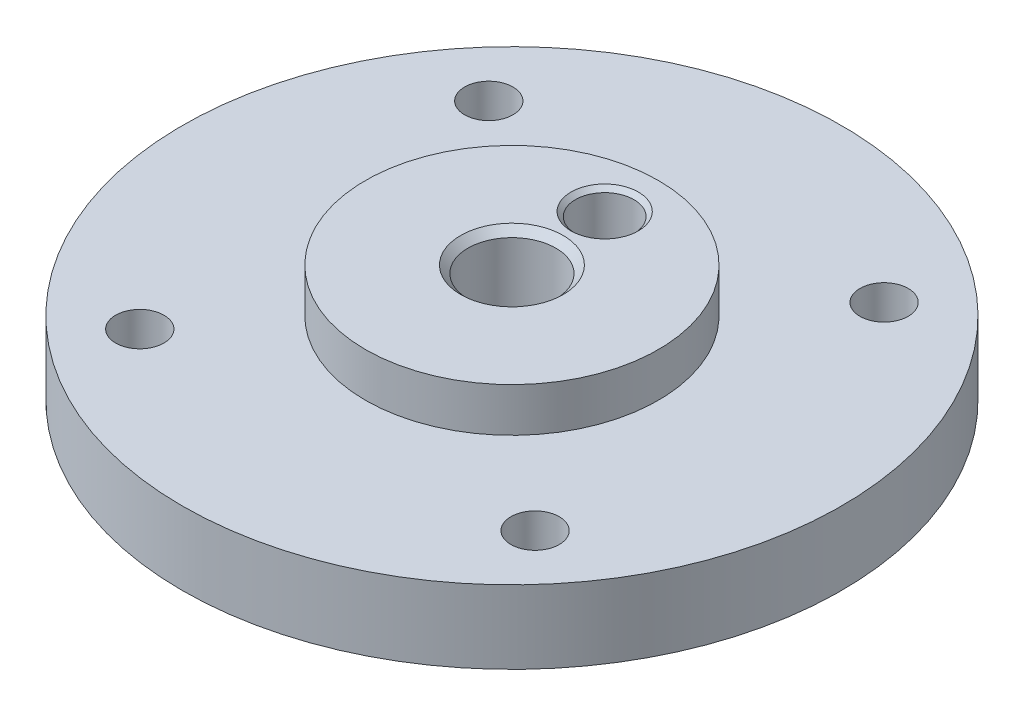
from build123d import *

# Parameters (mm, degrees)
SKETCH_1_R               = 22.5
EXTRUDE_1_DEPTH          = 5
SKETCH_2_R               = 10
EXTRUDE_2_DEPTH          = 5
EXTRUDE_START            = 3
SKETCH_4_R               = 10
EXTRUDE_3_DEPTH          = 3
CUT_EXTRUDE_2_DEPTH      = 35.372954485
CUT_EXTRUDE_2_DEPTH_BACK = 35.372954485
SKETCH_5_R               = 3
HOLE_WIZARD_M4_3_D       = 3.3
SKETCH_10_R              = 2
CUT_EXTRUDE_3_DEPTH      = 35.372954485
CHAMFER_2_SIZE           = 0.5
CHAMFER_4_SIZE           = 0.3


with BuildPart() as part:
    # 草图1 → 凸台-拉伸1 (new body)
    with BuildSketch(Plane(origin=(0, 0, 0), x_dir=(1, 0, 0), z_dir=(0, 1, 0))):
        Circle(SKETCH_1_R)
    extrude(amount=EXTRUDE_1_DEPTH)

    # 草图2 → 凸台-拉伸2 (add)
    with BuildSketch(Plane.XZ):
        Circle(SKETCH_2_R)
    extrude(amount=EXTRUDE_2_DEPTH)

    # 草图4 → 凸台-拉伸3 (add)
    with BuildSketch(Plane(origin=(0, 5, 0), x_dir=(1, 0, 0), z_dir=(0, 1, 0)).offset(EXTRUDE_START)):
        Circle(SKETCH_4_R)
    extrude(amount=-EXTRUDE_3_DEPTH)

    # 草图5 → 切除-拉伸2 (cut, two sides: drawn at the far end of the back side and taken through both)
    with BuildSketch(Plane(origin=(0, 8, 0), x_dir=(1, 0, 0), z_dir=(0, 1, 0)).offset(-CUT_EXTRUDE_2_DEPTH_BACK)):
        Circle(SKETCH_5_R)
    extrude(amount=CUT_EXTRUDE_2_DEPTH + CUT_EXTRUDE_2_DEPTH_BACK, mode=Mode.SUBTRACT)

    # M4 螺纹孔3 (through all)
    with Locations(Plane.XZ):
        with Locations((11.913336036, -13.493421527), (13.493421527, 11.913336036), (-11.913336036, 13.493421527), (-13.493421527, -11.913336036)):
            Hole(HOLE_WIZARD_M4_3_D / 2)

    # 草图10 → 切除-拉伸3 (cut, through all)
    with BuildSketch(Plane(origin=(0, 8, 0), x_dir=(1, 0, 0), z_dir=(0, 1, 0))):
        with Locations((0, 6.332219822)):
            Circle(SKETCH_10_R)
    extrude(amount=-CUT_EXTRUDE_3_DEPTH, mode=Mode.SUBTRACT)

    # 倒角2
    chamfer_2_edges = [part.edges().sort_by_distance(p)[0] for p in [
        (-3, -5, 0),
        (-3, 8, 0),
    ]]
    chamfer(chamfer_2_edges, length=CHAMFER_2_SIZE)

    # 倒角4
    chamfer_4_edges = [part.edges().sort_by_distance(p)[0] for p in [
        (-2, 8, -6.332219822),
    ]]
    chamfer(chamfer_4_edges, length=CHAMFER_4_SIZE)


solid = part.part
